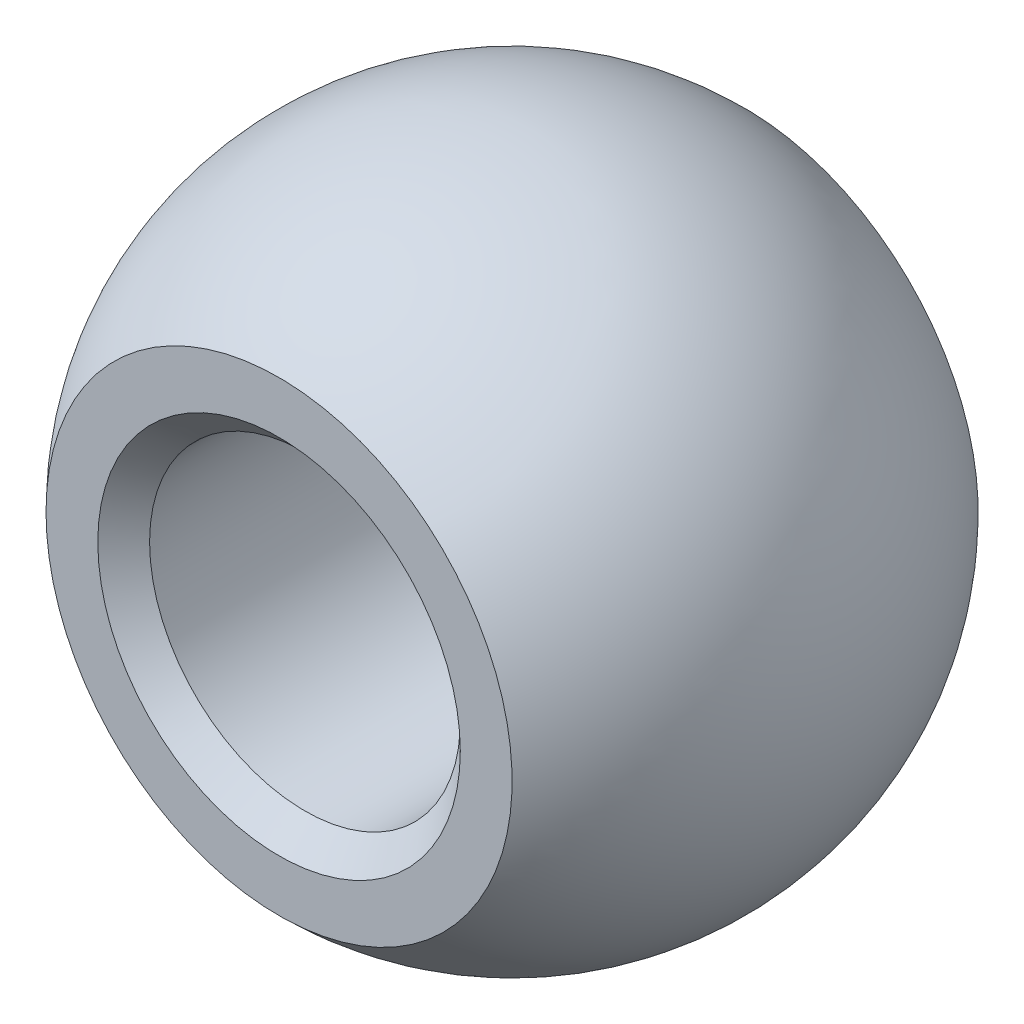
from build123d import *

# Parameters (mm, degrees)
SZKIC2_W                        = 14
SZKIC2_H                        = 14
DODANIE_WYCI_GNI_CIE1_DEPTH     = 4.5
WYTNIJ_WYCI_GNI_CIE1_DEPTH      = 11.062305899
WYTNIJ_WYCI_GNI_CIE1_DEPTH_BACK = 11.062305899
SZKIC7_R                        = 3
SFAZOWANIE1_SIZE                = 0.5


with BuildPart() as part:
    # Szkic2 → Dodanie-wyciągnięcie1 (new, symmetric)
    with BuildSketch(Plane.XY):
        Rectangle(SZKIC2_W, SZKIC2_H)
    extrude(amount=DODANIE_WYCI_GNI_CIE1_DEPTH, both=True)

    # Szkic6 → Wycięcie-obrót1 (revolve, cut)
    with BuildSketch(Plane(origin=(0, 0, 0), x_dir=(0, 0, -1), z_dir=(1, 0, 0))):
        with BuildLine():
            Line((0, 6.363961031), (0, 11.1169554))
            Line((0, 11.1169554), (-10.01359094, 11.1169554))
            Line((-10.01359094, 11.1169554), (-10.01359094, -12.11227334))
            Line((-10.01359094, -12.11227334), (0, -12.11227334))
            Line((0, -12.11227334), (0, -6.363961031))
            ThreePointArc((0, -6.363961031), (-6.363961031, 0), (0, 6.363961031))
        make_face()
    revolve(axis=Axis((0, -12.574301311, 0), (0, 1, 0)), mode=Mode.SUBTRACT)

    # Szkic7 → Wytnij-wyciągnięcie1 (cut, two sides: drawn at the far end of the back side and taken through both)
    with BuildSketch(Plane.XY.offset(-WYTNIJ_WYCI_GNI_CIE1_DEPTH_BACK)):
        Circle(SZKIC7_R)
    extrude(amount=WYTNIJ_WYCI_GNI_CIE1_DEPTH + WYTNIJ_WYCI_GNI_CIE1_DEPTH_BACK, mode=Mode.SUBTRACT)

    # Sfazowanie1
    sfazowanie1_edges = [part.edges().sort_by_distance(p)[0] for p in [
        (-3, 0, -4.5),
        (-3, 0, 4.5),
    ]]
    chamfer(sfazowanie1_edges, length=SFAZOWANIE1_SIZE)


solid = part.part
